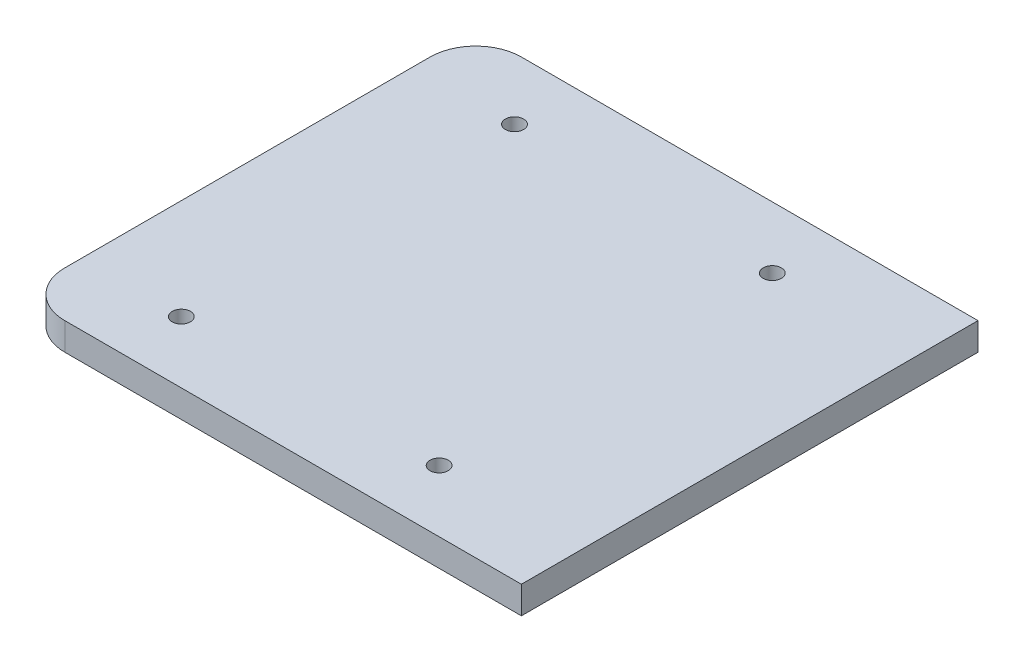
from build123d import *

# Parameters (mm, degrees)
BOSS_EXTRUDE1_DEPTH       = 6
FILLET1_R                 = 10
F_4_0MM_DOWEL_HOLE1_D     = 4
F_4_0MM_DOWEL_HOLE1_DEPTH = 98.31
F_4_0MM_DOWEL_HOLE1_TIP   = 1.201721238


with BuildPart() as part:
    # Sketch1 → Boss-Extrude1 (new body)
    with BuildSketch(Plane(origin=(0, 0, 0), x_dir=(1, 0, 0), z_dir=(0, 1, 0))):
        Polygon((50, 50), (60, 50), (60, -50), (50, -50), (-50, -50), (-50, 50), align=None)
    extrude(amount=BOSS_EXTRUDE1_DEPTH)

    # Fillet1
    fillet1_edges = [part.edges().sort_by_distance(p)[0] for p in [
        (-50, 3, -50),
        (-50, 3, 50),
    ]]
    fillet(fillet1_edges, radius=FILLET1_R)

    # Ø4.0mm Dowel Hole1
    with Locations(Plane(origin=(0, 6, 0), x_dir=(1, 0, 0), z_dir=(0, 1, 0))):
        with Locations((-28, 36.483109463), (28.463106056, 36.483109463), (-28, -36.483109463), (28.463106056, -36.483109463)):
            Hole(F_4_0MM_DOWEL_HOLE1_D / 2, depth=F_4_0MM_DOWEL_HOLE1_DEPTH)
            with Locations((0, 0, -(F_4_0MM_DOWEL_HOLE1_DEPTH + F_4_0MM_DOWEL_HOLE1_TIP / 2))):  # 118° drill point
                Cone(0, F_4_0MM_DOWEL_HOLE1_D / 2, F_4_0MM_DOWEL_HOLE1_TIP, mode=Mode.SUBTRACT)


solid = part.part
